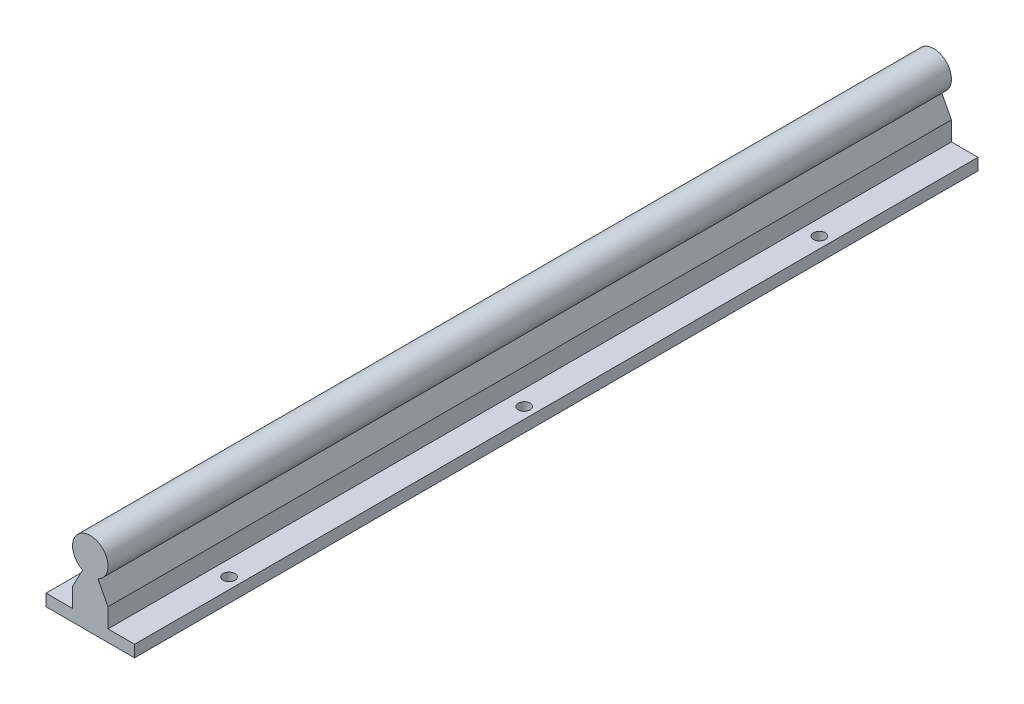
from build123d import *

# Parameters (mm, degrees)
BOSS_EXTRUDE1_DEPTH = 285.75
CUT_EXTRUDE1_REACH  = 289.467
SKETCH2_R           = 2


with BuildPart() as part:
    # Sketch1 → Boss-Extrude1 (new body)
    with BuildSketch(Plane.XY):
        with BuildLine():
            Line((19.707457755, 0), (-10.292542245, 0))
            Line((-10.292542245, 0), (-10.292542245, 4))
            Line((-10.292542245, 4), (-1.292542245, 4))
            Line((-1.292542245, 4), (-1.292542245, 10.5))
            Line((-1.292542245, 10.5), (2.107457755, 17))
            ThreePointArc((2.107457755, 17), (4.707457755, 28.407402334), (7.307457755, 17))
            Line((7.307457755, 17), (10.707457755, 10.5))
            Line((10.707457755, 10.5), (10.707457755, 4))
            Line((10.707457755, 4), (19.707457755, 4))
            Line((19.707457755, 4), (19.707457755, 0))
        make_face()
    extrude(amount=BOSS_EXTRUDE1_DEPTH)

    # Sketch2 → Cut-Extrude1 (cut, up to next)
    with BuildSketch(Plane(origin=(0, 4, 0), x_dir=(1, 0, 0), z_dir=(0, 1, 0)), mode=Mode.PRIVATE) as cut_extrude1_sk1:
        with Locations(Location((-6.542542245, -50, 0), (0, 0, 270))):
            Circle(SKETCH2_R)
    cut_extrude1_tool1 = extrude(cut_extrude1_sk1.sketch, amount=-CUT_EXTRUDE1_REACH, mode=Mode.PRIVATE) & part.part
    # Sketch2 → Cut-Extrude1 (cut, up to next)
    with BuildSketch(Plane(origin=(0, 4, 0), x_dir=(1, 0, 0), z_dir=(0, 1, 0)), mode=Mode.PRIVATE) as cut_extrude1_sk2:
        with Locations(Location((15.957457755, -50, 0), (0, 0, 270))):
            Circle(SKETCH2_R)
    cut_extrude1_tool2 = extrude(cut_extrude1_sk2.sketch, amount=-CUT_EXTRUDE1_REACH, mode=Mode.PRIVATE) & part.part
    # Sketch2 → Cut-Extrude1 (cut, up to next)
    with BuildSketch(Plane(origin=(0, 4, 0), x_dir=(1, 0, 0), z_dir=(0, 1, 0)), mode=Mode.PRIVATE) as cut_extrude1_sk3:
        with Locations(Location((15.957457755, -150, 0), (0, 0, 270))):
            Circle(SKETCH2_R)
    cut_extrude1_tool3 = extrude(cut_extrude1_sk3.sketch, amount=-CUT_EXTRUDE1_REACH, mode=Mode.PRIVATE) & part.part
    # Sketch2 → Cut-Extrude1 (cut, up to next)
    with BuildSketch(Plane(origin=(0, 4, 0), x_dir=(1, 0, 0), z_dir=(0, 1, 0)), mode=Mode.PRIVATE) as cut_extrude1_sk4:
        with Locations(Location((-6.542542245, -150, 0), (0, 0, 270))):
            Circle(SKETCH2_R)
    cut_extrude1_tool4 = extrude(cut_extrude1_sk4.sketch, amount=-CUT_EXTRUDE1_REACH, mode=Mode.PRIVATE) & part.part
    # Sketch2 → Cut-Extrude1 (cut, up to next)
    with BuildSketch(Plane(origin=(0, 4, 0), x_dir=(1, 0, 0), z_dir=(0, 1, 0)), mode=Mode.PRIVATE) as cut_extrude1_sk5:
        with Locations(Location((15.957457755, -250, 0), (0, 0, 270))):
            Circle(SKETCH2_R)
    cut_extrude1_tool5 = extrude(cut_extrude1_sk5.sketch, amount=-CUT_EXTRUDE1_REACH, mode=Mode.PRIVATE) & part.part
    # Sketch2 → Cut-Extrude1 (cut, up to next)
    with BuildSketch(Plane(origin=(0, 4, 0), x_dir=(1, 0, 0), z_dir=(0, 1, 0)), mode=Mode.PRIVATE) as cut_extrude1_sk6:
        with Locations(Location((-6.542542245, -250, 0), (0, 0, 270))):
            Circle(SKETCH2_R)
    cut_extrude1_tool6 = extrude(cut_extrude1_sk6.sketch, amount=-CUT_EXTRUDE1_REACH, mode=Mode.PRIVATE) & part.part
    add(cut_extrude1_tool1.solids().sort_by_distance((-6.542542, 4, 50))[0], mode=Mode.SUBTRACT)
    add(cut_extrude1_tool2.solids().sort_by_distance((15.957458, 4, 50))[0], mode=Mode.SUBTRACT)
    add(cut_extrude1_tool3.solids().sort_by_distance((15.957458, 4, 150))[0], mode=Mode.SUBTRACT)
    add(cut_extrude1_tool4.solids().sort_by_distance((-6.542542, 4, 150))[0], mode=Mode.SUBTRACT)
    add(cut_extrude1_tool5.solids().sort_by_distance((15.957458, 4, 250))[0], mode=Mode.SUBTRACT)
    add(cut_extrude1_tool6.solids().sort_by_distance((-6.542542, 4, 250))[0], mode=Mode.SUBTRACT)


solid = part.part
